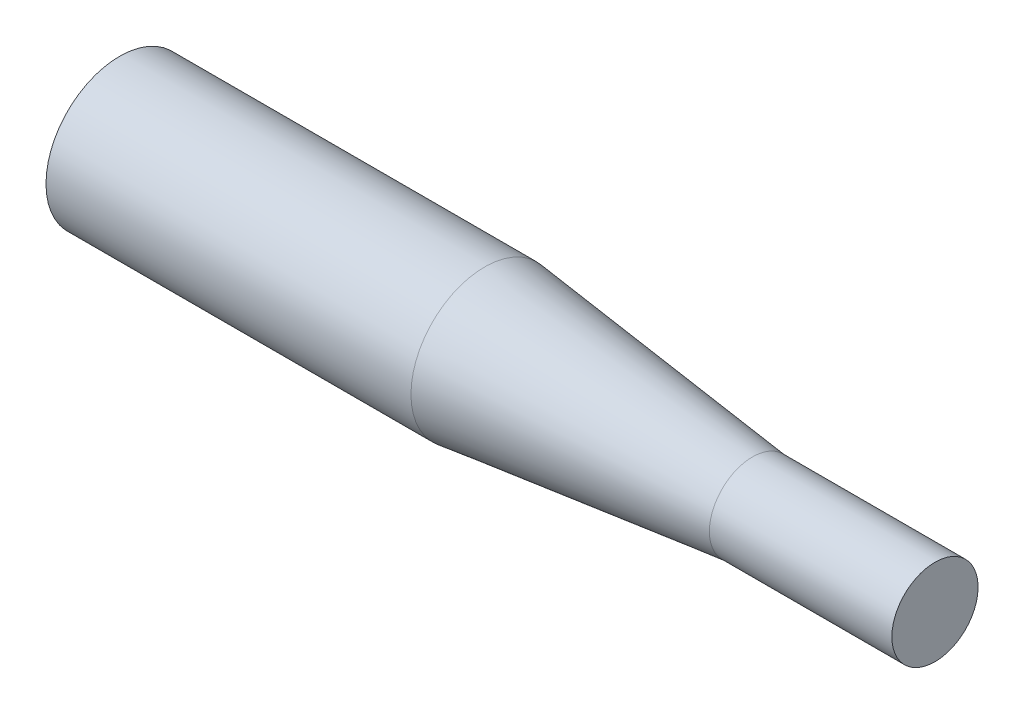
from build123d import *


with BuildPart() as part:
    # Sketch1 → Revolve1 (revolve)
    with BuildSketch(Plane(origin=(0, 0, 0), x_dir=(1, 0, 0), z_dir=(0, 1, 0)), mode=Mode.PRIVATE) as revolve1_sk:
        Polygon((-101.6, 20.4978), (0, 20.4978), (74.58423447, 11.999999876), (125.38423447, 11.999999876), (125.38423447, 0), (-101.6, 0), align=None)
    revolve(revolve1_sk.sketch.rotate(Axis((-121.454105892, 0, 0), (1, 0, 0)), 180), axis=Axis((-121.454105892, 0, 0), (1, 0, 0)))


solid = part.part
